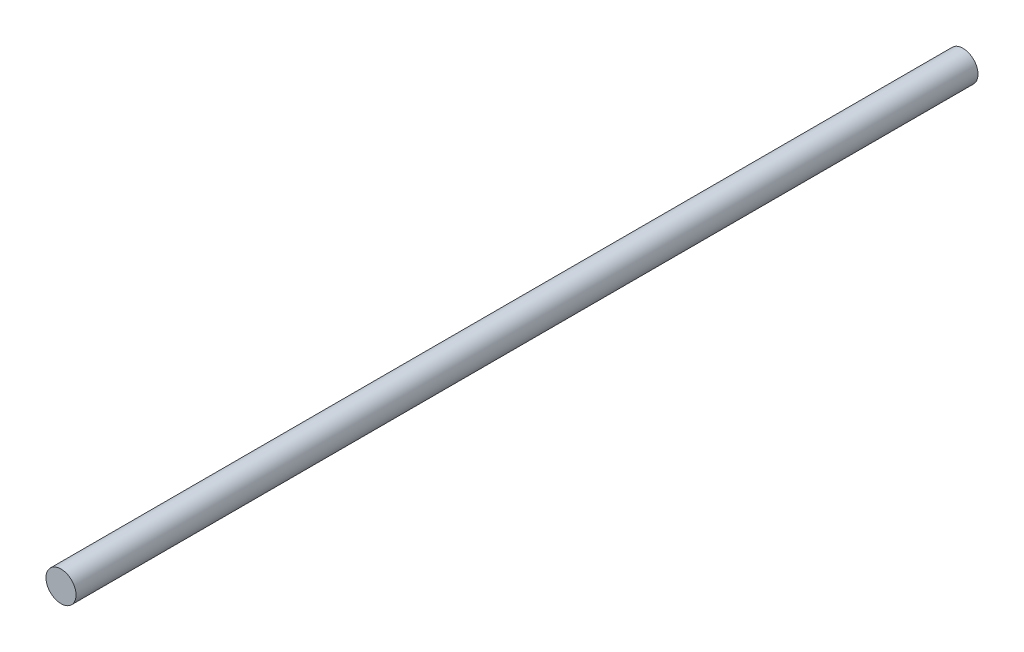
from build123d import *

# Parameters (mm, degrees)
SKETCH_1_R      = 1
EXTRUDE_1_DEPTH = 60


with BuildPart() as part:
    # ｽｹｯﾁ1 → ﾎﾞｽ - 押し出し1 (new body)
    with BuildSketch(Plane.XY):
        Circle(SKETCH_1_R)
    extrude(amount=EXTRUDE_1_DEPTH)


solid = part.part
